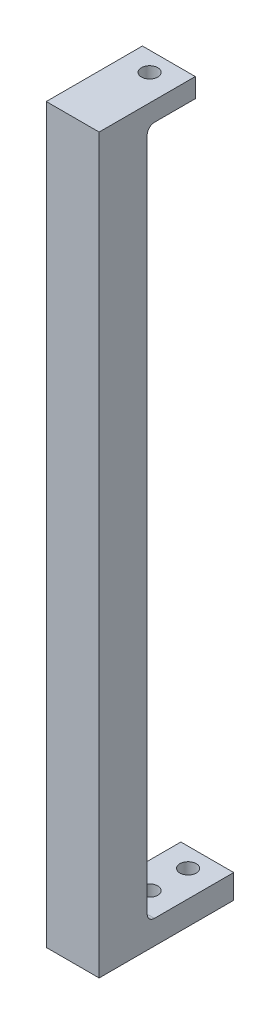
from build123d import *

# Parameters (mm, degrees)
SKETCH1_W           = 11
SKETCH1_H           = 10
BOSS_EXTRUDE1_DEPTH = 76.2
SKETCH3_W           = 11
SKETCH3_H           = 20
SKETCH3_R           = 1.7
BOSS_EXTRUDE3_DEPTH = 4
BOSS_EXTRUDE4_START = -5
SKETCH4_W           = 11
SKETCH4_H           = 28
SKETCH4_R           = 1.7
BOSS_EXTRUDE4_DEPTH = 5
FILLET1_R           = 1.5


with BuildPart() as part:
    # Sketch1 → Boss-Extrude1 (new, symmetric)
    with BuildSketch(Plane(origin=(0, 0, 0), x_dir=(1, 0, 0), z_dir=(0, 1, 0))):
        Rectangle(SKETCH1_W, SKETCH1_H)
    extrude(amount=BOSS_EXTRUDE1_DEPTH, both=True)

    # Sketch3 → Boss-Extrude3 (add)
    with BuildSketch(Plane(origin=(0, 76.2, 0), x_dir=(1, 0, 0), z_dir=(0, 1, 0))):
        with Locations((0, 5)):
            Rectangle(SKETCH3_W, SKETCH3_H)
        with Locations(Location((0, 11, 0), (0, 0, 270))):
            Circle(SKETCH3_R, mode=Mode.SUBTRACT)
    extrude(amount=-BOSS_EXTRUDE3_DEPTH)

    # Sketch4 → Boss-Extrude4 (add)
    with BuildSketch(Plane.XZ.offset(76.2).offset(BOSS_EXTRUDE4_START)):
        with Locations((0, -9)):
            Rectangle(SKETCH4_W, SKETCH4_H)
        with Locations(Location((0, -11, 0), (0, 0, 90))):
            Circle(SKETCH4_R, mode=Mode.SUBTRACT)
        with Locations(Location((0, -19, 0), (0, 0, 270))):
            Circle(SKETCH4_R, mode=Mode.SUBTRACT)
    extrude(amount=BOSS_EXTRUDE4_DEPTH)

    # Fillet1
    fillet1_edges = [part.edges().sort_by_distance(p)[0] for p in [
        (0, 72.2, -5),
        (0, -71.2, -5),
    ]]
    fillet(fillet1_edges, radius=FILLET1_R)


solid = part.part
